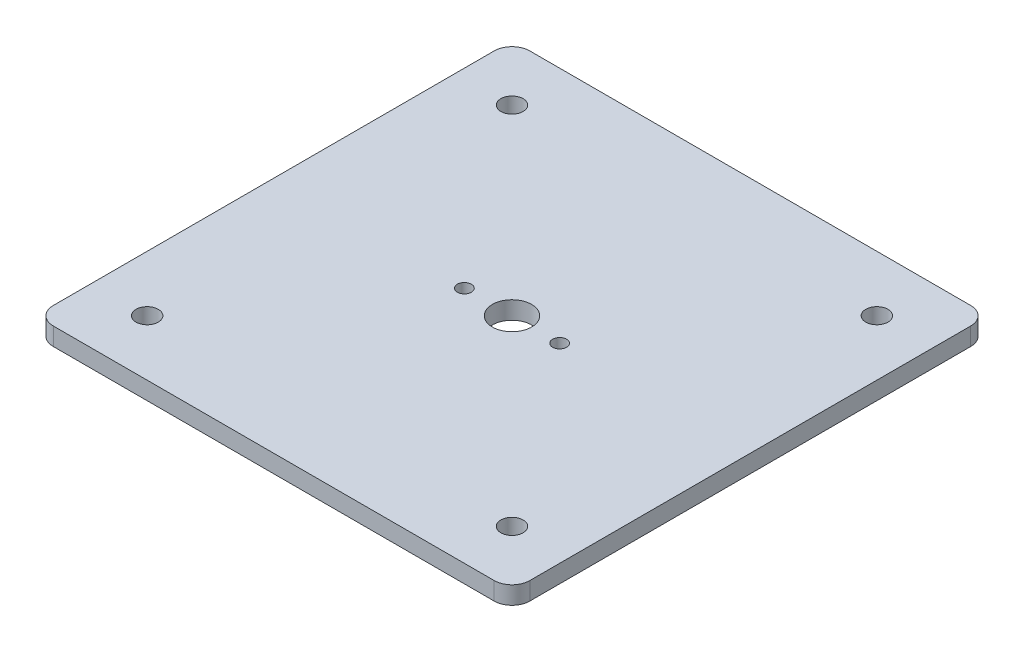
from build123d import *

# Parameters (mm, degrees)
SKETCH1_W             = 85
SKETCH1_H             = 85
BOSS_EXTRUDE1_DEPTH   = 3.175
SKETCH2_R             = 1.985
CUT_EXTRUDE1_DEPTH    = 121.250075364
LPATTERN1_COUNT       = 2
LPATTERN1_PITCH       = 65.09
LPATTERN1_COUNT_DIR2  = 2
LPATTERN1_PITCH_DIR2  = 65.09
FILLET1_R             = 3.175
SKETCH3_R             = 3.5
CUT_EXTRUDE2_DEPTH    = 121.250075364
M3X0_5_TAPPED_HOLE1_D = 2.5


with BuildPart() as part:
    # Sketch1 → Boss-Extrude1 (new body)
    with BuildSketch(Plane(origin=(0, 0, 0), x_dir=(1, 0, 0), z_dir=(0, 1, 0))):
        with Locations((42.5, 42.5)):
            Rectangle(SKETCH1_W, SKETCH1_H)
    extrude(amount=BOSS_EXTRUDE1_DEPTH)

    # Sketch2 → Cut-Extrude1 (cut, through all)
    with BuildSketch(Plane(origin=(0, 3.175, 0), x_dir=(1, 0, 0), z_dir=(0, 1, 0))):
        with Locations(Location((9.955, 75.045, 0), (0, 0, 270))):
            Circle(SKETCH2_R)
    cut_extrude1 = extrude(amount=-CUT_EXTRUDE1_DEPTH, mode=Mode.SUBTRACT)

    # LPattern1: Cut-Extrude1 2 × 2
    with Locations(*[(j * LPATTERN1_PITCH_DIR2, 0, i * LPATTERN1_PITCH) for i in range(LPATTERN1_COUNT) for j in range(LPATTERN1_COUNT_DIR2) if (i, j) != (0, 0)]):
        add(cut_extrude1, mode=Mode.SUBTRACT)

    # Fillet1
    fillet1_edges = [part.edges().sort_by_distance(p)[0] for p in [
        (0, 1.5875, -85),
        (85, 1.5875, -85),
        (85, 1.5875, 0),
        (0, 1.5875, 0),
    ]]
    fillet(fillet1_edges, radius=FILLET1_R)

    # Sketch3 → Cut-Extrude2 (cut, through all)
    with BuildSketch(Plane(origin=(0, 3.175, 0), x_dir=(1, 0, 0), z_dir=(0, 1, 0))):
        with Locations(Location((42.5, 42.5, 0), (0, 0, 270))):
            Circle(SKETCH3_R)
    extrude(amount=-CUT_EXTRUDE2_DEPTH, mode=Mode.SUBTRACT)

    # M3x0.5 Tapped Hole1 (through all)
    with Locations(Plane(origin=(0, 3.175, 0), x_dir=(1, 0, 0), z_dir=(0, 1, 0))):
        with Locations((34, 42.5), (51, 42.5)):
            Hole(M3X0_5_TAPPED_HOLE1_D / 2)


solid = part.part
